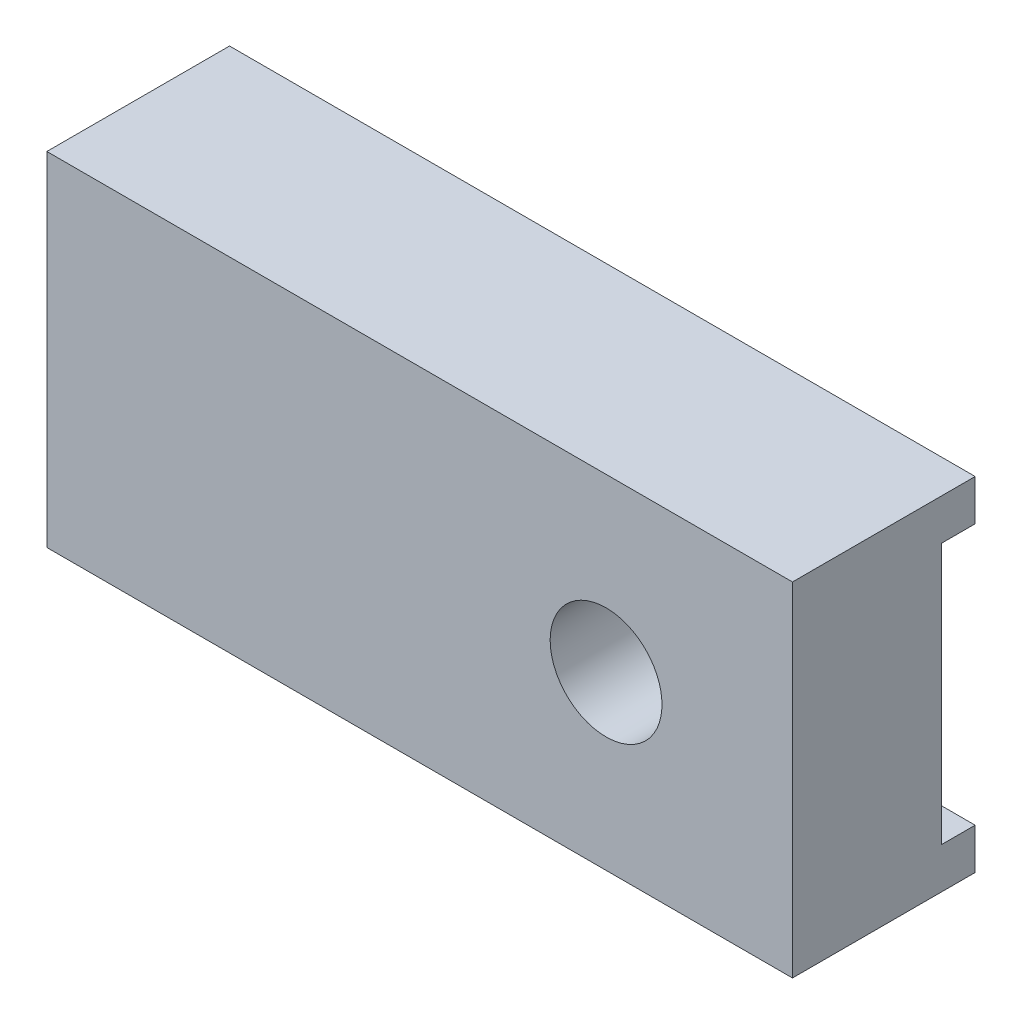
from build123d import *

# Parameters (mm, degrees)
RESSALTO_EXTRUS_O2_DEPTH = 9.2
ESBO_O5_R                = 2.15
CORTE_EXTRUS_O2_DEPTH    = 9.2
CHANFRO2_SIZE            = 0.3
SKETCH1_W                = 12.014068267
SKETCH1_H                = 17.223276929
CUT_EXTRUDE1_DEPTH       = 25
SKETCH3_W                = 4
SKETCH3_H                = 9.2
BOSS_EXTRUDE1_DEPTH      = 5
SKETCH4_R                = 1.5
CUT_EXTRUDE3_DEPTH       = 10
SKETCH5_W                = 42.60578415
SKETCH5_H                = 33.509789151
CUT_EXTRUDE4_DEPTH       = 1.1
SKETCH6_W                = 58.176505701
SKETCH6_H                = 25.888094607
CUT_EXTRUDE5_DEPTH       = 1.1
SKETCH7_W                = 20
SKETCH7_H                = 4.9
BOSS_EXTRUDE2_DEPTH      = 1.1
SKETCH8_W                = 20
SKETCH8_H                = 4.9
BOSS_EXTRUDE3_DEPTH      = 1.1


with BuildPart() as part:
    # Esboço4 → Ressalto-extrusão2 (new body)
    with BuildSketch(Plane(origin=(0, 0, 0), x_dir=(1, 0, 0), z_dir=(0, 1, 0))):
        with BuildLine():
            Line((-19.2, 2.35), (-19.2, 1.65))
            ThreePointArc((-19.2, 1.65), (-19.170710678, 1.579289322), (-19.1, 1.55))
            Line((-19.1, 1.55), (-18.1, 1.55))
            ThreePointArc((-18.1, 1.55), (-18.029289322, 1.579289322), (-18, 1.65))
            Line((-18, 1.65), (-18, 2.35))
            ThreePointArc((-18, 2.35), (-17.970710678, 2.420710678), (-17.9, 2.45))
            Line((-17.9, 2.45), (-17.3, 2.45))
            ThreePointArc((-17.3, 2.45), (-17.229289322, 2.420710678), (-17.2, 2.35))
            Line((-17.2, 2.35), (-17.2, 1.65))
            ThreePointArc((-17.2, 1.65), (-17.170710678, 1.579289322), (-17.1, 1.55))
            Line((-17.1, 1.55), (-16.1, 1.55))
            ThreePointArc((-16.1, 1.55), (-16.029289322, 1.579289322), (-16, 1.65))
            Line((-16, 1.65), (-16, 2.35))
            ThreePointArc((-16, 2.35), (-15.970710678, 2.420710678), (-15.9, 2.45))
            Line((-15.9, 2.45), (-15.3, 2.45))
            ThreePointArc((-15.3, 2.45), (-15.229289322, 2.420710678), (-15.2, 2.35))
            Line((-15.2, 2.35), (-15.2, 1.65))
            ThreePointArc((-15.2, 1.65), (-15.170710678, 1.579289322), (-15.1, 1.55))
            Line((-15.1, 1.55), (-14.1, 1.55))
            ThreePointArc((-14.1, 1.55), (-14.029289322, 1.579289322), (-14, 1.65))
            Line((-14, 1.65), (-14, 2.35))
            ThreePointArc((-14, 2.35), (-13.970710678, 2.420710678), (-13.9, 2.45))
            Line((-13.9, 2.45), (-13.3, 2.45))
            ThreePointArc((-13.3, 2.45), (-13.229289322, 2.420710678), (-13.2, 2.35))
            Line((-13.2, 2.35), (-13.2, 1.65))
            ThreePointArc((-13.2, 1.65), (-13.170710678, 1.579289322), (-13.1, 1.55))
            Line((-13.1, 1.55), (-12.1, 1.55))
            ThreePointArc((-12.1, 1.55), (-12.029289322, 1.579289322), (-12, 1.65))
            Line((-12, 1.65), (-12, 2.35))
            ThreePointArc((-12, 2.35), (-11.970710678, 2.420710678), (-11.9, 2.45))
            Line((-11.9, 2.45), (-11.3, 2.45))
            ThreePointArc((-11.3, 2.45), (-11.229289322, 2.420710678), (-11.2, 2.35))
            Line((-11.2, 2.35), (-11.2, 1.65))
            ThreePointArc((-11.2, 1.65), (-11.170710678, 1.579289322), (-11.1, 1.55))
            Line((-11.1, 1.55), (-10.1, 1.55))
            ThreePointArc((-10.1, 1.55), (-10.029289322, 1.579289322), (-10, 1.65))
            Line((-10, 1.65), (-10, 2.35))
            ThreePointArc((-10, 2.35), (-9.970710678, 2.420710678), (-9.9, 2.45))
            Line((-9.9, 2.45), (-9.3, 2.45))
            ThreePointArc((-9.3, 2.45), (-9.229289322, 2.420710678), (-9.2, 2.35))
            Line((-9.2, 2.35), (-9.2, 1.65))
            ThreePointArc((-9.2, 1.65), (-9.170710678, 1.579289322), (-9.1, 1.55))
            Line((-9.1, 1.55), (-8.1, 1.55))
            ThreePointArc((-8.1, 1.55), (-8.029289322, 1.579289322), (-8, 1.65))
            Line((-8, 1.65), (-8, 2.35))
            ThreePointArc((-8, 2.35), (-7.970710678, 2.420710678), (-7.9, 2.45))
            Line((-7.9, 2.45), (-7.3, 2.45))
            ThreePointArc((-7.3, 2.45), (-7.229289322, 2.420710678), (-7.2, 2.35))
            Line((-7.2, 2.35), (-7.2, 1.65))
            ThreePointArc((-7.2, 1.65), (-7.170710678, 1.579289322), (-7.1, 1.55))
            Line((-7.1, 1.55), (7.1, 1.55))
            ThreePointArc((7.1, 1.55), (7.170710678, 1.579289322), (7.2, 1.65))
            Line((7.2, 1.65), (7.2, 2.35))
            ThreePointArc((7.2, 2.35), (7.229289322, 2.420710678), (7.3, 2.45))
            Line((7.3, 2.45), (7.9, 2.45))
            ThreePointArc((7.9, 2.45), (7.970710678, 2.420710678), (8, 2.35))
            Line((8, 2.35), (8, 1.65))
            ThreePointArc((8, 1.65), (8.029289322, 1.579289322), (8.1, 1.55))
            Line((8.1, 1.55), (9.1, 1.55))
            ThreePointArc((9.1, 1.55), (9.170710678, 1.579289322), (9.2, 1.65))
            Line((9.2, 1.65), (9.2, 2.35))
            ThreePointArc((9.2, 2.35), (9.229289322, 2.420710678), (9.3, 2.45))
            Line((9.3, 2.45), (9.9, 2.45))
            ThreePointArc((9.9, 2.45), (9.970710678, 2.420710678), (10, 2.35))
            Line((10, 2.35), (10, 1.65))
            ThreePointArc((10, 1.65), (10.029289322, 1.579289322), (10.1, 1.55))
            Line((10.1, 1.55), (11.1, 1.55))
            ThreePointArc((11.1, 1.55), (11.170710678, 1.579289322), (11.2, 1.65))
            Line((11.2, 1.65), (11.2, 2.35))
            ThreePointArc((11.2, 2.35), (11.229289322, 2.420710678), (11.3, 2.45))
            Line((11.3, 2.45), (11.9, 2.45))
            ThreePointArc((11.9, 2.45), (11.970710678, 2.420710678), (12, 2.35))
            Line((12, 2.35), (12, 1.65))
            ThreePointArc((12, 1.65), (12.029289322, 1.579289322), (12.1, 1.55))
            Line((12.1, 1.55), (13.1, 1.55))
            ThreePointArc((13.1, 1.55), (13.170710678, 1.579289322), (13.2, 1.65))
            Line((13.2, 1.65), (13.2, 2.35))
            ThreePointArc((13.2, 2.35), (13.229289322, 2.420710678), (13.3, 2.45))
            Line((13.3, 2.45), (13.9, 2.45))
            ThreePointArc((13.9, 2.45), (13.970710678, 2.420710678), (14, 2.35))
            Line((14, 2.35), (14, 1.65))
            ThreePointArc((14, 1.65), (14.029289322, 1.579289322), (14.1, 1.55))
            Line((14.1, 1.55), (15.1, 1.55))
            ThreePointArc((15.1, 1.55), (15.170710678, 1.579289322), (15.2, 1.65))
            Line((15.2, 1.65), (15.2, 2.35))
            ThreePointArc((15.2, 2.35), (15.229289322, 2.420710678), (15.3, 2.45))
            Line((15.3, 2.45), (15.9, 2.45))
            ThreePointArc((15.9, 2.45), (15.970710678, 2.420710678), (16, 2.35))
            Line((16, 2.35), (16, 1.65))
            ThreePointArc((16, 1.65), (16.029289322, 1.579289322), (16.1, 1.55))
            Line((16.1, 1.55), (17.1, 1.55))
            ThreePointArc((17.1, 1.55), (17.170710678, 1.579289322), (17.2, 1.65))
            Line((17.2, 1.65), (17.2, 2.35))
            ThreePointArc((17.2, 2.35), (17.229289322, 2.420710678), (17.3, 2.45))
            Line((17.3, 2.45), (17.9, 2.45))
            ThreePointArc((17.9, 2.45), (17.970710678, 2.420710678), (18, 2.35))
            Line((18, 2.35), (18, 1.65))
            ThreePointArc((18, 1.65), (18.029289322, 1.579289322), (18.1, 1.55))
            Line((18.1, 1.55), (19.1, 1.55))
            ThreePointArc((19.1, 1.55), (19.170710678, 1.579289322), (19.2, 1.65))
            Line((19.2, 1.65), (19.2, 2.35))
            ThreePointArc((19.2, 2.35), (19.229289322, 2.420710678), (19.3, 2.45))
            Line((19.3, 2.45), (19.9, 2.45))
            ThreePointArc((19.9, 2.45), (19.970710678, 2.420710678), (20, 2.35))
            Line((20, 2.35), (20, -2.45))
            Line((20, -2.45), (-20, -2.45))
            Line((-20, -2.45), (-20, 2.35))
            ThreePointArc((-20, 2.35), (-19.970710678, 2.420710678), (-19.9, 2.45))
            Line((-19.9, 2.45), (-19.3, 2.45))
            ThreePointArc((-19.3, 2.45), (-19.229289322, 2.420710678), (-19.2, 2.35))
        make_face()
    extrude(amount=RESSALTO_EXTRUS_O2_DEPTH)

    # Esboço5 → Corte-extrusão2 (cut)
    with BuildSketch(Plane(origin=(0, 0, -1.55), x_dir=(-1, 0, 0), z_dir=(0, 0, -1))):
        with Locations((0, 4.6)):
            Circle(ESBO_O5_R)
    extrude(amount=-CORTE_EXTRUS_O2_DEPTH, mode=Mode.SUBTRACT)

    # Chanfro2
    chanfro2_edges = [part.edges().sort_by_distance(p)[0] for p in [
        (2.15, 4.6, -1.55),
    ]]
    chamfer(chanfro2_edges, length=CHANFRO2_SIZE)

    # Sketch1 → Cut-Extrude1 (cut)
    with BuildSketch(Plane(origin=(20, 0, 0), x_dir=(0, 0, -1), z_dir=(1, 0, 0))):
        with Locations((-0.254525551, 3.53223116)):
            Rectangle(SKETCH1_W, SKETCH1_H)
    extrude(amount=-CUT_EXTRUDE1_DEPTH, mode=Mode.SUBTRACT)

    # Sketch3 → Boss-Extrude1 (add)
    with BuildSketch(Plane(origin=(-5, 0, 0), x_dir=(0, 0, -1), z_dir=(1, 0, 0))):
        with Locations((-0.45, 4.6)):
            Rectangle(SKETCH3_W, SKETCH3_H)
    extrude(amount=BOSS_EXTRUDE1_DEPTH)

    # Sketch4 → Cut-Extrude3 (cut)
    with BuildSketch(Plane(origin=(0, 0, -1.55), x_dir=(-1, 0, 0), z_dir=(0, 0, -1))):
        with Locations((5, 4.6)):
            Circle(SKETCH4_R)
    extrude(amount=-CUT_EXTRUDE3_DEPTH, mode=Mode.SUBTRACT)

    # Sketch5 → Cut-Extrude4 (cut)
    with BuildSketch(Plane.XZ):
        with Locations((-12.27909741, -6.492410197)):
            Rectangle(SKETCH5_W, SKETCH5_H)
    extrude(amount=-CUT_EXTRUDE4_DEPTH, mode=Mode.SUBTRACT)

    # Sketch6 → Cut-Extrude5 (cut)
    with BuildSketch(Plane(origin=(0, 9.2, 0), x_dir=(1, 0, 0), z_dir=(0, 1, 0))):
        with Locations((-5.279993837, 3.701095613)):
            Rectangle(SKETCH6_W, SKETCH6_H)
    extrude(amount=-CUT_EXTRUDE5_DEPTH, mode=Mode.SUBTRACT)

    # Sketch7 → Boss-Extrude2 (add)
    with BuildSketch(Plane(origin=(0, 8.1, 0), x_dir=(1, 0, 0), z_dir=(0, 1, 0))):
        with Locations((-10, 0)):
            Rectangle(SKETCH7_W, SKETCH7_H)
    extrude(amount=BOSS_EXTRUDE2_DEPTH)

    # Sketch8 → Boss-Extrude3 (add)
    with BuildSketch(Plane.XZ.offset(-1.1)):
        with Locations((-10, 0)):
            Rectangle(SKETCH8_W, SKETCH8_H)
    extrude(amount=BOSS_EXTRUDE3_DEPTH)


solid = part.part
